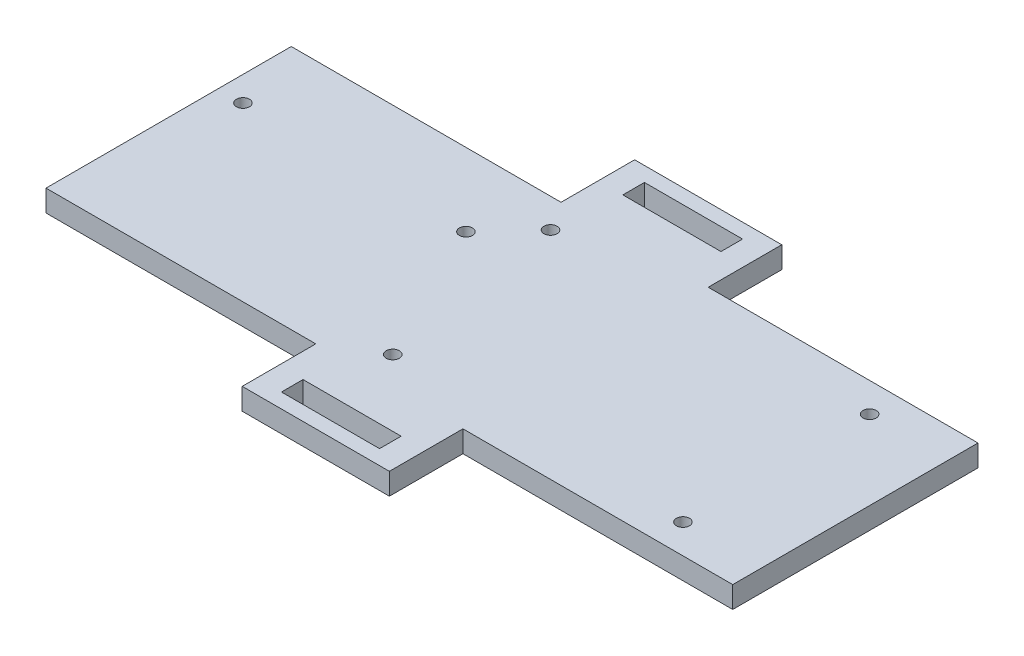
from build123d import *

# Parameters (mm, degrees)
BOSS_EXTRUDE1_DEPTH  = 5.588
SKETCH2_W            = 25.4
SKETCH2_H            = 5.588
CUT_EXTRUDE1_DEPTH   = 103.543043372
M3_CLEARANCE_HOLE1_D = 3.4
M3_CLEARANCE_HOLE2_D = 3.4


with BuildPart() as part:
    # Sketch1 → Boss-Extrude1 (new body)
    with BuildSketch(Plane(origin=(0, 0, 0), x_dir=(1, 0, 0), z_dir=(0, 1, 0))):
        Polygon((19.05, 31.75), (19.05, 50.8), (-19.05, 50.8), (-19.05, 31.75), (-88.9, 31.75), (-88.9, -31.75), (-19.05, -31.75), (-19.05, -50.8), (19.05, -50.8), (19.05, -31.75), (88.9, -31.75), (88.9, 31.75), align=None)
    extrude(amount=BOSS_EXTRUDE1_DEPTH)

    # Sketch2 → Cut-Extrude1 (cut, through all)
    with BuildSketch(Plane(origin=(0, 5.588, 0), x_dir=(1, 0, 0), z_dir=(0, 1, 0))):
        with Locations((0, 44.196)):
            Rectangle(SKETCH2_W, SKETCH2_H)
        with Locations((0, -44.196)):
            Rectangle(SKETCH2_W, SKETCH2_H)
    extrude(amount=-CUT_EXTRUDE1_DEPTH, mode=Mode.SUBTRACT)

    # M3 Clearance Hole1 (through all)
    with Locations(Plane(origin=(0, 5.588, 0), x_dir=(1, 0, 0), z_dir=(0, 1, 0))):
        with Locations((-14.1986, 24.1681), (68.4276, 24.1681), (68.4276, -24.1681), (-6.7056, -24.1681)):
            Hole(M3_CLEARANCE_HOLE1_D / 2)

    # M3 Clearance Hole2 (through all)
    with Locations(Plane(origin=(0, 5.588, 0), x_dir=(1, 0, 0), z_dir=(0, 1, 0))):
        with Locations((-24.765, 12.827), (-82.4865, 12.827)):
            Hole(M3_CLEARANCE_HOLE2_D / 2)


solid = part.part
